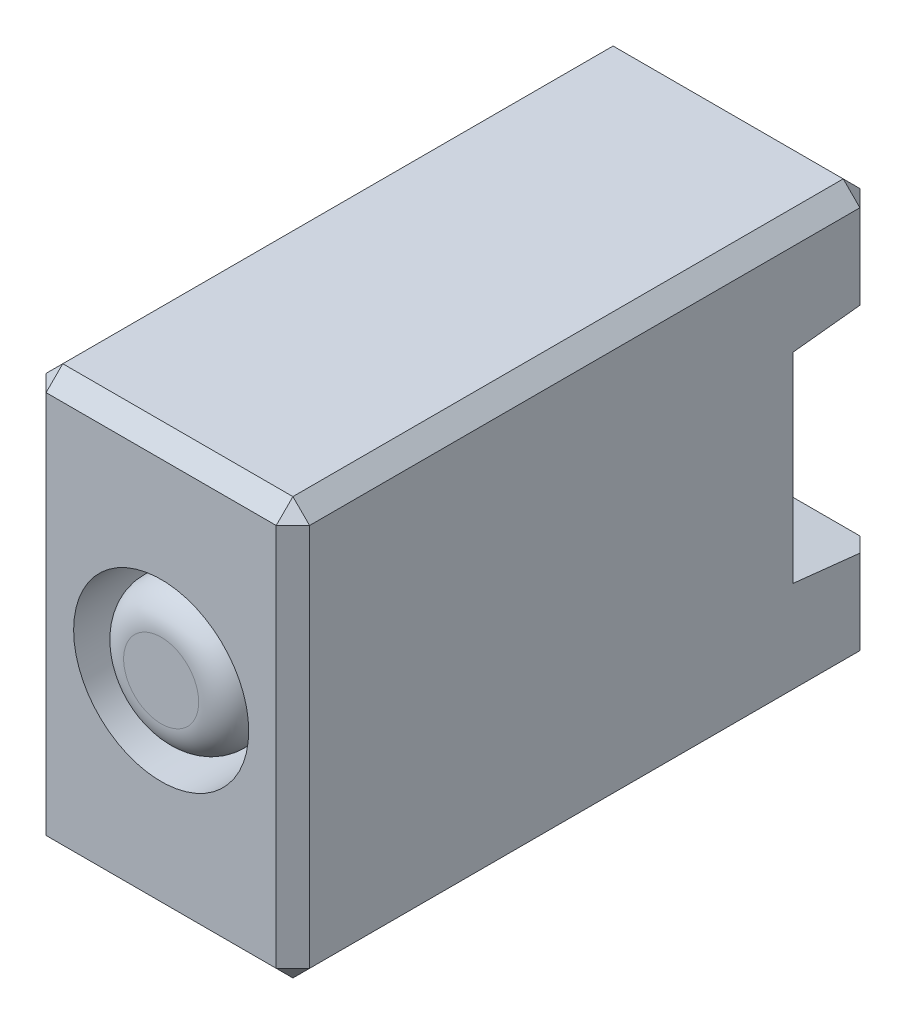
from build123d import *

# Parameters (mm, degrees)
SKETCH_3_W               = 15.8
SKETCH_3_H               = 25
EXTRUDE_2_DEPTH          = 35
SKETCH_4_R               = 5.25
SKETCH_4_R_2             = 4.25
CUT_EXTRUDE_1_DEPTH      = 10
CUT_EXTRUDE_3_DEPTH      = 38.995526052
CUT_EXTRUDE_3_DEPTH_BACK = 38.995526052
FILLET_1_R               = 2
CHAMFER_1_SIZE           = 1


with BuildPart() as part:
    # 스케치3 → 보스-돌출2 (new body)
    with BuildSketch(Plane.XY):
        Rectangle(SKETCH_3_W, SKETCH_3_H)
    extrude(amount=EXTRUDE_2_DEPTH)

    # 스케치4 → 컷-돌출1 (cut)
    with BuildSketch(Plane.XY.offset(35)):
        Circle(SKETCH_4_R)
        Circle(SKETCH_4_R_2, mode=Mode.SUBTRACT)
    extrude(amount=-CUT_EXTRUDE_1_DEPTH, mode=Mode.SUBTRACT)

    # 스케치5 → 컷-돌출3 (cut, two sides: drawn at the far end of the back side and taken through both)
    with BuildSketch(Plane(origin=(0, 0, 0), x_dir=(0, 0, -1), z_dir=(1, 0, 0)).offset(-CUT_EXTRUDE_3_DEPTH_BACK)):
        Polygon((2.109074987, 6.770011202), (-5, 6.004306325), (-5, -6.004306325), (2.109074987, -6.770011202), align=None)
    extrude(amount=CUT_EXTRUDE_3_DEPTH + CUT_EXTRUDE_3_DEPTH_BACK, mode=Mode.SUBTRACT)

    # 필렛1
    fillet_1_edges = [part.edges().sort_by_distance(p)[0] for p in [
        (-4.25, 0, 35),
    ]]
    fillet(fillet_1_edges, radius=FILLET_1_R)

    # 모따기1
    chamfer_1_edges = [part.edges().sort_by_distance(p)[0] for p in [
        (-7.9, 0, 35),
        (0, -12.5, 35),
        (7.9, 9.521423383, 0),
        (-7.9, -9.521423383, 0),
        (7.9, 0, 35),
        (0, -12.5, 0),
        (-7.9, 9.521423383, 0),
        (0, 12.5, 0),
        (7.9, -9.521423383, 0),
        (0, 12.5, 35),
        (7.9, -12.5, 17.5),
        (-7.9, -12.5, 17.5),
        (-7.9, 12.5, 17.5),
        (7.9, 12.5, 17.5),
    ]]
    chamfer(chamfer_1_edges, length=CHAMFER_1_SIZE)


solid = part.part
